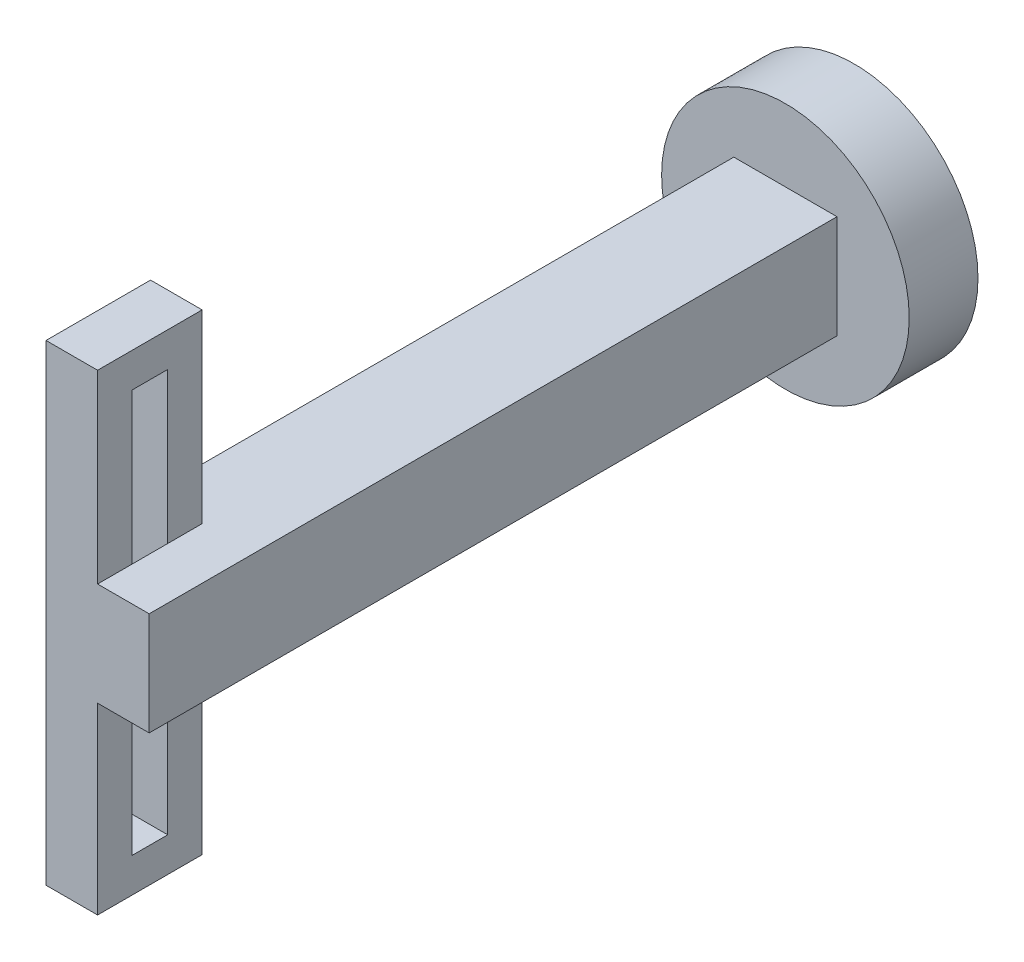
from build123d import *

# Parameters (mm, degrees)
SKETCH1_R           = 3.6
BOSS_EXTRUDE1_DEPTH = 2
SKETCH2_W           = 3
SKETCH2_H           = 3
BOSS_EXTRUDE2_DEPTH = 20
SKETCH3_W           = 1.5
SKETCH3_H           = 3.039979134
CUT_EXTRUDE1_DEPTH  = 3
SKETCH4_W           = 3.039979134
SKETCH4_H           = 13.71909755
SKETCH4_W_2         = 1.039979134
SKETCH4_H_2         = 11.71909755
BOSS_EXTRUDE3_DEPTH = 1.5


with BuildPart() as part:
    # Sketch1 → Boss-Extrude1 (new body)
    with BuildSketch(Plane.XY):
        Circle(SKETCH1_R)
    extrude(amount=BOSS_EXTRUDE1_DEPTH)

    # Sketch2 → Boss-Extrude2 (add)
    with BuildSketch(Plane.XY.offset(2)):
        Rectangle(SKETCH2_W, SKETCH2_H)
    extrude(amount=BOSS_EXTRUDE2_DEPTH)

    # Sketch3 → Cut-Extrude1 (cut)
    with BuildSketch(Plane(origin=(0, 1.5, 0), x_dir=(1, 0, 0), z_dir=(0, 1, 0))):
        with Locations((-0.75, -20.480010433)):
            Rectangle(SKETCH3_W, SKETCH3_H)
    extrude(amount=-CUT_EXTRUDE1_DEPTH, mode=Mode.SUBTRACT)

    # Sketch4 → Boss-Extrude3 (add)
    with BuildSketch(Plane.ZY):
        with Locations((20.480010433, 0.024038237)):
            Rectangle(SKETCH4_W, SKETCH4_H)
        with Locations((20.480010433, 0.024038237)):
            Rectangle(SKETCH4_W_2, SKETCH4_H_2, mode=Mode.SUBTRACT)
    extrude(amount=BOSS_EXTRUDE3_DEPTH)


solid = part.part
